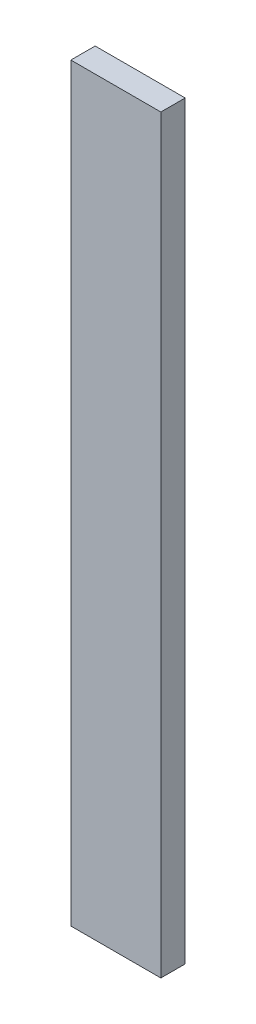
from build123d import *

# Parameters (mm, degrees)
ESQUISSE1_W        = 30
ESQUISSE1_H        = 250
BOSS_EXTRU_1_DEPTH = 8.1


with BuildPart() as part:
    # Esquisse1 → Boss.-Extru.1 (new body)
    with BuildSketch(Plane.XY):
        with Locations((15, 125)):
            Rectangle(ESQUISSE1_W, ESQUISSE1_H)
    extrude(amount=BOSS_EXTRU_1_DEPTH)


solid = part.part
